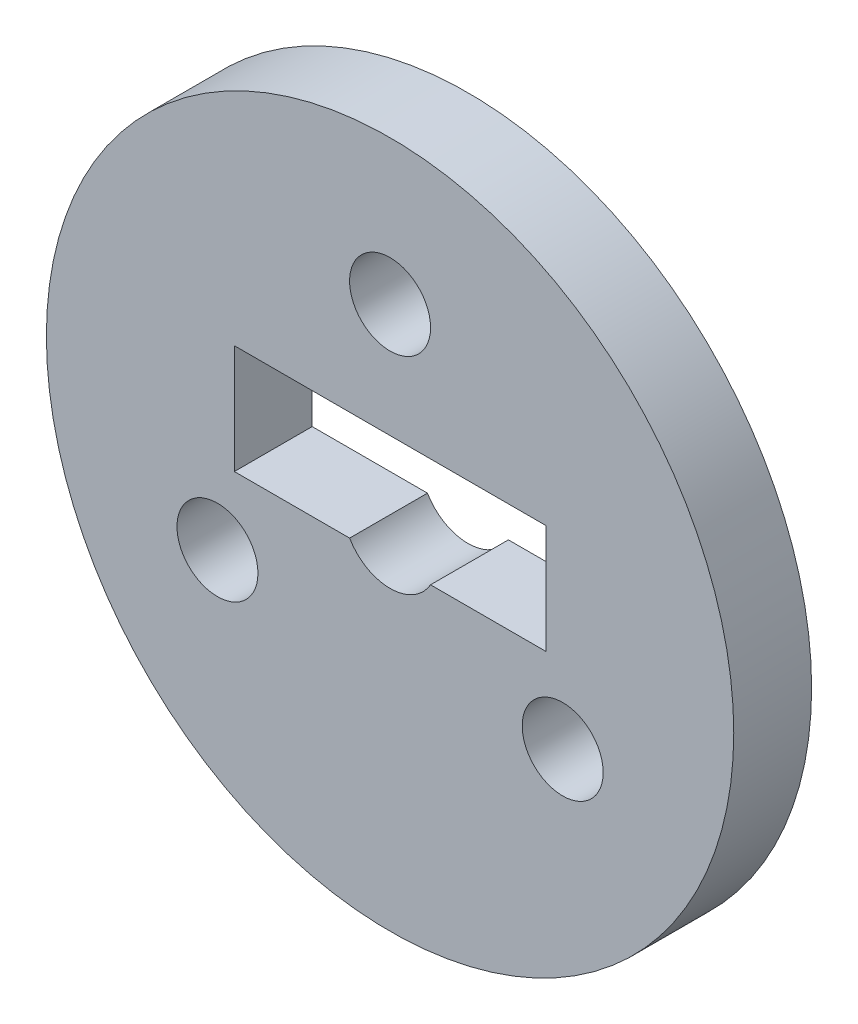
from build123d import *

# Parameters (mm, degrees)
SKETCH_1_R      = 22.071639064
SKETCH_1_R_2    = 2.6
EXTRUDE_1_DEPTH = 5


with BuildPart() as part:
    # 스케치1 → 보스-돌출1 (new body)
    with BuildSketch(Plane.XY):
        Circle(SKETCH_1_R)
        with Locations((0, 12.8)):
            Circle(SKETCH_1_R_2, mode=Mode.SUBTRACT)
        with Locations((-11.085125168, -6.4)):
            Circle(SKETCH_1_R_2, mode=Mode.SUBTRACT)
        with Locations((11.085125168, -6.4)):
            Circle(SKETCH_1_R_2, mode=Mode.SUBTRACT)
        with BuildLine():
            Line((-10, 5.5), (10, 5.5))
            Line((10, 5.5), (10, -1.5))
            Line((10, -1.5), (2.598076211, -1.5))
            ThreePointArc((2.598076211, -1.5), (0, -3), (-2.598076211, -1.5))
            Line((-2.598076211, -1.5), (-10, -1.5))
            Line((-10, -1.5), (-10, 5.5))
        make_face(mode=Mode.SUBTRACT)
    extrude(amount=EXTRUDE_1_DEPTH)


solid = part.part
